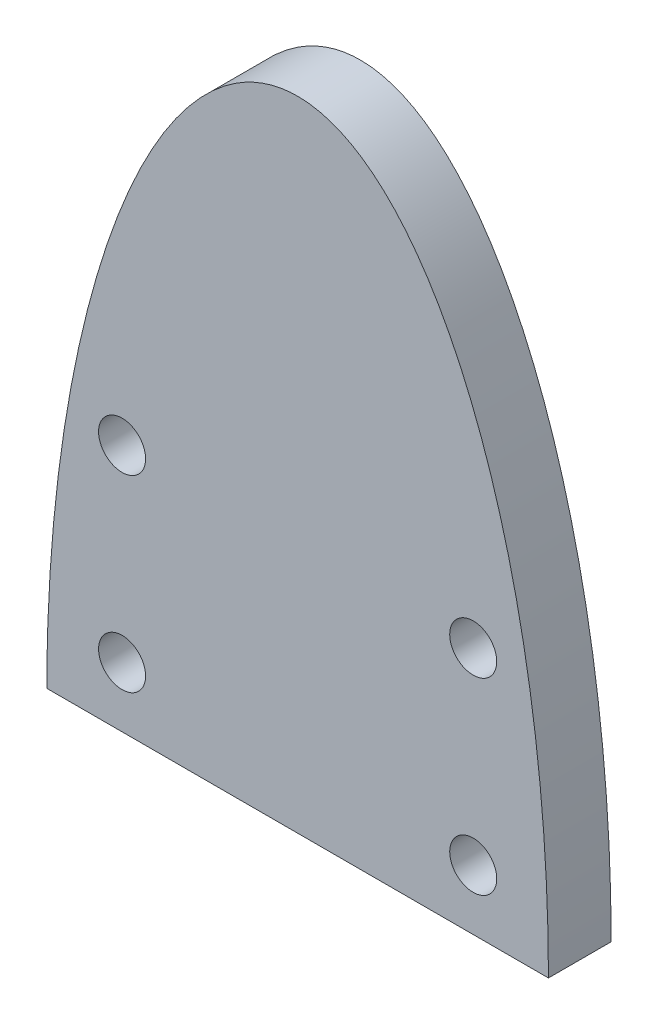
from build123d import *

# Parameters (mm, degrees)
BOSS_EXTRUDE1_DEPTH = 12.7
SKETCH2_R           = 4.7625
CUT_EXTRUDE1_DEPTH  = 12.7


with BuildPart() as part:
    # Sketch1 → Boss-Extrude1 (new body)
    with BuildSketch(Plane.XY):
        with BuildLine():
            Line((0, 0), (101.6, 0))
            add(Edge.make_bspline(
                [(101.6, 0), (101.6, 129.286), (50.8, 129.286), (0, 129.286), (0, 0)],
                knots=[4.71238898, 4.71238898, 4.71238898, 6.283185307, 6.283185307, 7.853981634, 7.853981634, 7.853981634], degree=2, weights=[1, 0.707106781, 1, 0.707106781, 1]))
        make_face()
    extrude(amount=BOSS_EXTRUDE1_DEPTH)

    # Sketch2 → Cut-Extrude1 (cut)
    with BuildSketch(Plane(origin=(0, 0, 0), x_dir=(-1, 0, 0), z_dir=(0, 0, -1))):
        with Locations((-86.36, 50.2666)):
            Circle(SKETCH2_R)
        with Locations((-86.36, 12.1666)):
            Circle(SKETCH2_R)
        with Locations((-15.24, 50.2666)):
            Circle(SKETCH2_R)
        with Locations((-15.24, 12.1666)):
            Circle(SKETCH2_R)
    extrude(amount=-CUT_EXTRUDE1_DEPTH, mode=Mode.SUBTRACT)


solid = part.part
